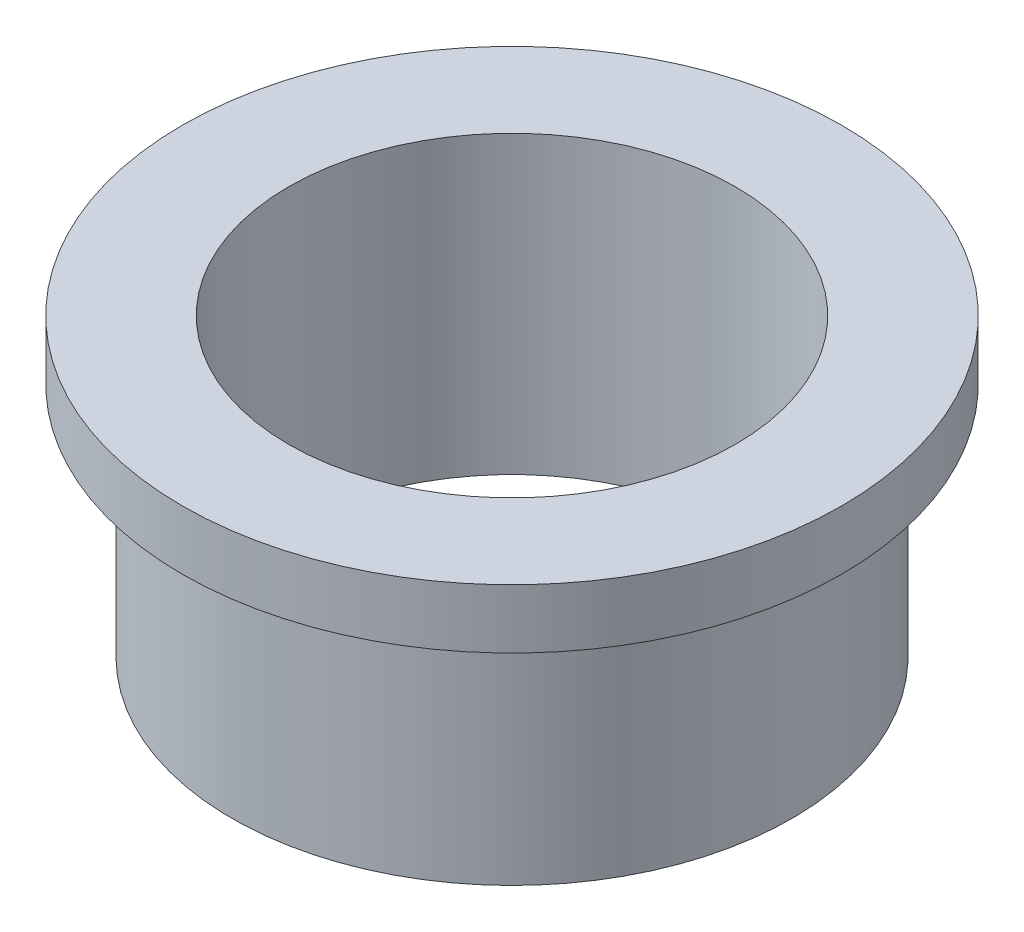
from build123d import *

# Parameters (mm, degrees)
SKETCH1_W = 1.525
SKETCH1_H = 5.6
FILLET1_R = 0.25


with BuildPart() as part:
    # Sketch1 → Revolve1 (revolve)
    with BuildSketch(Plane.XY, mode=Mode.PRIVATE) as revolve1_sk:
        with Locations((0.7625, 2.8)):
            Rectangle(SKETCH1_W, SKETCH1_H)
        Polygon((0, 5.6), (1.525, 5.6), (1.31, 5.972390924), (1.31, 6.352390924), (2.86, 6.352390924), (2.86, 7.942390924), (0, 7.942390924), align=None)
    revolve(revolve1_sk.sketch.rotate(Axis((-6, 0, 0), (0, 1, 0)), 90), axis=Axis((-6, 0, 0), (0, 1, 0)))

    # Fillet1
    fillet1_edges = [part.edges().sort_by_distance(p)[0] for p in [
        (-6, 6.352390924, 7.31),
    ]]
    fillet(fillet1_edges, radius=FILLET1_R)


solid = part.part
